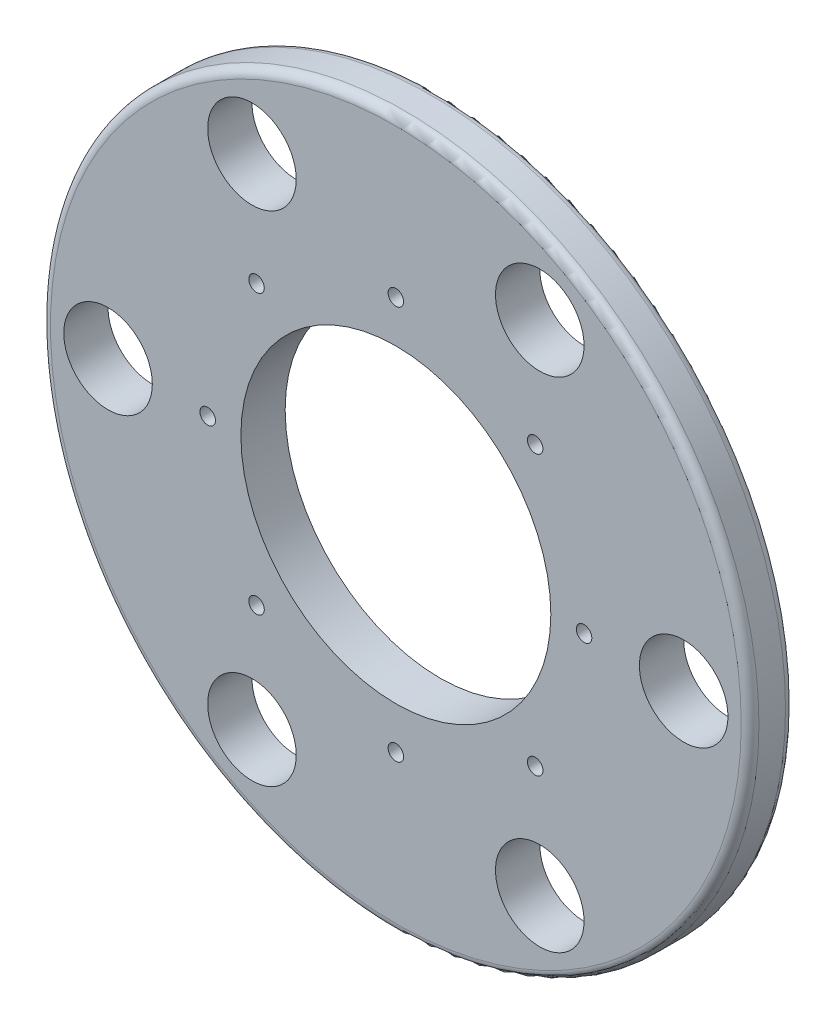
from build123d import *

# Parameters (mm, degrees)
SKETCH_3_R          = 80
EXTRUDE_1_DEPTH     = 10
SKETCH_4_R          = 35
CUT_EXTRUDE_1_DEPTH = 7
SKETCH_6_R          = 10
CUT_EXTRUDE_3_DEPTH = 10
SKETCH_5_R          = 1.75
CUT_EXTRUDE_4_DEPTH = 10
SKETCH_7_R          = 35
CUT_EXTRUDE_5_DEPTH = 20
FILLET_1_R          = 2


with BuildPart() as part:
    # 草图3 → 凸台-拉伸1 (new body)
    with BuildSketch(Plane.XY):
        Circle(SKETCH_3_R)
    extrude(amount=-EXTRUDE_1_DEPTH)

    # 草图4 → 切除-拉伸1 (cut)
    with BuildSketch(Plane.XY):
        Circle(SKETCH_4_R)
    extrude(amount=-CUT_EXTRUDE_1_DEPTH, mode=Mode.SUBTRACT)

    # 草图6 → 切除-拉伸3 (cut)
    with BuildSketch(Plane.XY):
        with Locations((-32.5, 56.291651246)):
            Circle(SKETCH_6_R)
        with BuildLine():
            ThreePointArc((-75, 0), (-65, -10), (-55, 0))
            Line((-55, 0), (-75, 0))
        make_face()
        with BuildLine():
            Line((-75, 0), (-55, 0))
            ThreePointArc((-55, 0), (-65, 10), (-75, 0))
        make_face()
        with Locations((-32.5, -56.291651246)):
            Circle(SKETCH_6_R)
        with Locations((32.5, -56.291651246)):
            Circle(SKETCH_6_R)
        with Locations((65, 0)):
            Circle(SKETCH_6_R)
        with Locations((32.5, 56.291651246)):
            Circle(SKETCH_6_R)
    extrude(amount=-CUT_EXTRUDE_3_DEPTH, mode=Mode.SUBTRACT)

    # 草图5 → 切除-拉伸4 (cut)
    with BuildSketch(Plane.XY):
        with Locations((0, 44.5)):
            Circle(SKETCH_5_R)
        with Locations((31.466251763, 31.466251763)):
            Circle(SKETCH_5_R)
        with Locations((42.5, 0)):
            Circle(SKETCH_5_R)
        with Locations((31.466251763, -31.466251763)):
            Circle(SKETCH_5_R)
        with Locations((-31.466251763, -31.466251763)):
            Circle(SKETCH_5_R)
        with BuildLine():
            ThreePointArc((-44.25, 0), (-42.5, -1.75), (-40.75, 0))
            Line((-40.75, 0), (-44.25, 0))
        make_face()
        with BuildLine():
            Line((-44.25, 0), (-40.75, 0))
            ThreePointArc((-40.75, 0), (-42.5, 1.75), (-44.25, 0))
        make_face()
        with Locations((-31.466251763, 31.466251763)):
            Circle(SKETCH_5_R)
        with Locations((0, -44.5)):
            Circle(SKETCH_5_R)
    extrude(amount=-CUT_EXTRUDE_4_DEPTH, mode=Mode.SUBTRACT)

    # 草图7 → 切除-拉伸5 (cut, symmetric)
    with BuildSketch(Plane.XY):
        Circle(SKETCH_7_R)
    extrude(amount=CUT_EXTRUDE_5_DEPTH, both=True, mode=Mode.SUBTRACT)

    # 圆角1
    fillet_1_edges = [part.edges().sort_by_distance(p)[0] for p in [
        (-80, 0, 0),
        (-80, 0, -10),
    ]]
    fillet(fillet_1_edges, radius=FILLET_1_R)


solid = part.part
